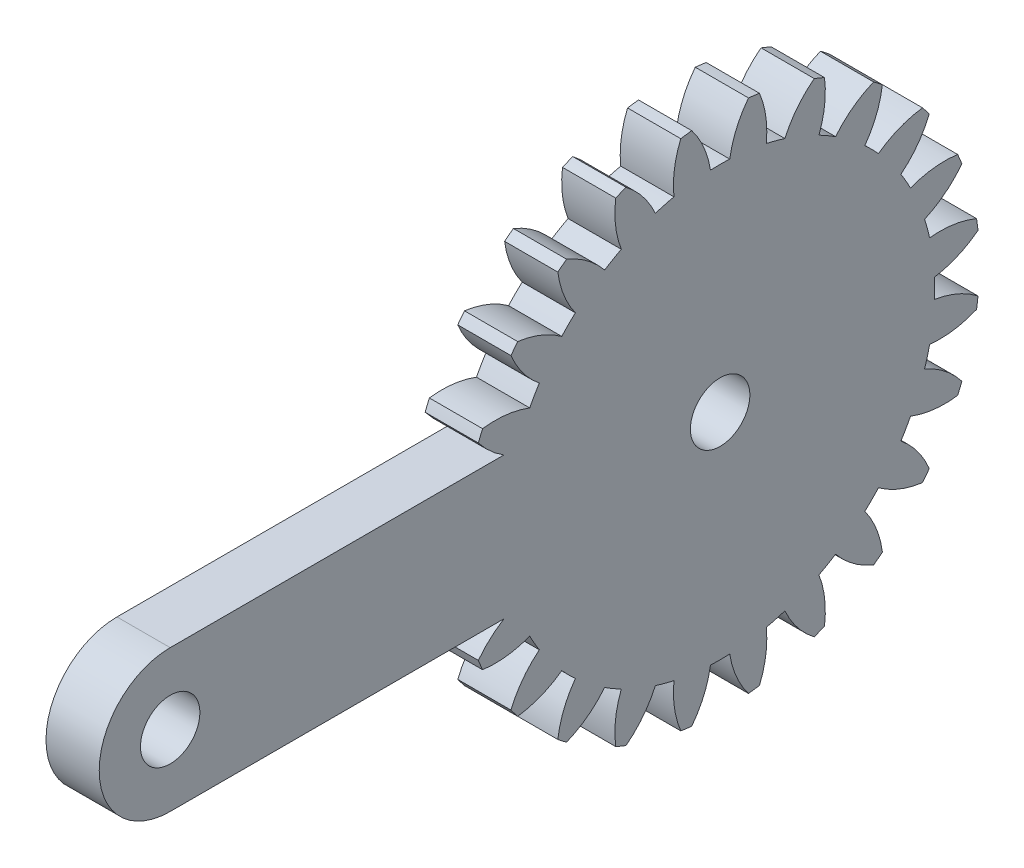
from build123d import *

# Parameters (mm, degrees)
SKETCH1_R           = 1.675
BOSS_EXTRUDE1_DEPTH = 3
SKETCH2_R           = 1.675
BOSS_EXTRUDE2_DEPTH = 3


with BuildPart() as part:
    # Sketch1 → Boss-Extrude1 (new body)
    with BuildSketch(Plane(origin=(3, 0, 0), x_dir=(0, 0, -1), z_dir=(1, 0, 0))):
        with BuildLine():
            ThreePointArc((-14.537314892, 1.599093719), (-13.375367565, 0.916420874), (-12.080565177, 0.542722358))
            ThreePointArc((-12.080565177, 0.542722358), (-12.09275, 0), (-12.080565177, -0.542722358))
            ThreePointArc((-12.080565177, -0.542722358), (-13.375367565, -0.916420874), (-14.537314892, -1.599093719))
            ThreePointArc((-14.537314892, -1.599093719), (-14.499881098, -1.908945561), (-14.455843809, -2.217928037))
            ThreePointArc((-14.455843809, -2.217928037), (-13.156800143, -2.576605271), (-11.809396783, -2.602450802))
            ThreePointArc((-11.809396783, -2.602450802), (-11.680699536, -3.129834008), (-11.528463019, -3.650909885))
            ThreePointArc((-11.528463019, -3.650909885), (-12.682425791, -4.346994451), (-13.62809199, -5.30713988))
            ThreePointArc((-13.62809199, -5.30713988), (-13.511738163, -5.596745198), (-13.389230859, -5.883801663))
            ThreePointArc((-13.389230859, -5.883801663), (-12.041618533, -5.894040025), (-10.733437515, -5.57027124))
            ThreePointArc((-10.733437515, -5.57027124), (-10.472628702, -6.046375), (-10.190715157, -6.510293938))
            ThreePointArc((-10.190715157, -6.510293938), (-11.125197659, -7.48132754), (-11.79013714, -8.65351323))
            ThreePointArc((-11.79013714, -8.65351323), (-11.602792602, -8.903135899), (-11.410163953, -9.148703928))
            ThreePointArc((-11.410163953, -9.148703928), (-10.105820521, -8.809805691), (-8.926012217, -8.158486898))
            ThreePointArc((-8.926012217, -8.158486898), (-8.550865528, -8.550865528), (-8.158486898, -8.926012217))
            ThreePointArc((-8.158486898, -8.926012217), (-8.809805691, -10.105820521), (-9.148703928, -11.410163953))
            ThreePointArc((-9.148703928, -11.410163953), (-8.903135899, -11.602792602), (-8.65351323, -11.79013714))
            ThreePointArc((-8.65351323, -11.79013714), (-7.48132754, -11.125197659), (-6.510293938, -10.190715157))
            ThreePointArc((-6.510293938, -10.190715157), (-6.046375, -10.472628702), (-5.57027124, -10.733437515))
            ThreePointArc((-5.57027124, -10.733437515), (-5.894040025, -12.041618533), (-5.883801663, -13.389230859))
            ThreePointArc((-5.883801663, -13.389230859), (-5.596745198, -13.511738163), (-5.30713988, -13.62809199))
            ThreePointArc((-5.30713988, -13.62809199), (-4.346994451, -12.682425791), (-3.650909885, -11.528463019))
            ThreePointArc((-3.650909885, -11.528463019), (-3.129834008, -11.680699536), (-2.602450802, -11.809396783))
            ThreePointArc((-2.602450802, -11.809396783), (-2.576605271, -13.156800143), (-2.217928037, -14.455843809))
            ThreePointArc((-2.217928037, -14.455843809), (-1.908945561, -14.499881098), (-1.599093719, -14.537314892))
            ThreePointArc((-1.599093719, -14.537314892), (-0.916420874, -13.375367565), (-0.542722358, -12.080565177))
            ThreePointArc((-0.542722358, -12.080565177), (0, -12.09275), (0.542722358, -12.080565177))
            ThreePointArc((0.542722358, -12.080565177), (0.916420874, -13.375367565), (1.599093719, -14.537314892))
            ThreePointArc((1.599093719, -14.537314892), (1.908945561, -14.499881098), (2.217928037, -14.455843809))
            ThreePointArc((2.217928037, -14.455843809), (2.576605271, -13.156800143), (2.602450802, -11.809396783))
            ThreePointArc((2.602450802, -11.809396783), (3.129834008, -11.680699536), (3.650909885, -11.528463019))
            ThreePointArc((3.650909885, -11.528463019), (4.346994451, -12.682425791), (5.30713988, -13.62809199))
            ThreePointArc((5.30713988, -13.62809199), (5.596745198, -13.511738163), (5.883801663, -13.389230859))
            ThreePointArc((5.883801663, -13.389230859), (5.894040025, -12.041618533), (5.57027124, -10.733437515))
            ThreePointArc((5.57027124, -10.733437515), (6.046375, -10.472628702), (6.510293938, -10.190715157))
            ThreePointArc((6.510293938, -10.190715157), (7.48132754, -11.125197659), (8.65351323, -11.79013714))
            ThreePointArc((8.65351323, -11.79013714), (8.903135899, -11.602792602), (9.148703928, -11.410163953))
            ThreePointArc((9.148703928, -11.410163953), (8.809805691, -10.105820521), (8.158486898, -8.926012217))
            ThreePointArc((8.158486898, -8.926012217), (8.550865528, -8.550865528), (8.926012217, -8.158486898))
            ThreePointArc((8.926012217, -8.158486898), (10.105820521, -8.809805691), (11.410163953, -9.148703928))
            ThreePointArc((11.410163953, -9.148703928), (11.602792602, -8.903135899), (11.79013714, -8.65351323))
            ThreePointArc((11.79013714, -8.65351323), (11.125197659, -7.48132754), (10.190715157, -6.510293938))
            ThreePointArc((10.190715157, -6.510293938), (10.472628702, -6.046375), (10.733437515, -5.57027124))
            ThreePointArc((10.733437515, -5.57027124), (12.041618533, -5.894040025), (13.389230859, -5.883801663))
            ThreePointArc((13.389230859, -5.883801663), (13.511738163, -5.596745198), (13.62809199, -5.30713988))
            ThreePointArc((13.62809199, -5.30713988), (12.682425791, -4.346994451), (11.528463019, -3.650909885))
            ThreePointArc((11.528463019, -3.650909885), (11.680699536, -3.129834008), (11.809396783, -2.602450802))
            ThreePointArc((11.809396783, -2.602450802), (13.156800143, -2.576605271), (14.455843809, -2.217928037))
            ThreePointArc((14.455843809, -2.217928037), (14.499881098, -1.908945561), (14.537314892, -1.599093719))
            ThreePointArc((14.537314892, -1.599093719), (13.375367565, -0.916420874), (12.080565177, -0.542722358))
            ThreePointArc((12.080565177, -0.542722358), (12.09275, 0), (12.080565177, 0.542722358))
            ThreePointArc((12.080565177, 0.542722358), (13.375367565, 0.916420874), (14.537314892, 1.599093719))
            ThreePointArc((14.537314892, 1.599093719), (14.499881098, 1.908945561), (14.455843809, 2.217928037))
            ThreePointArc((14.455843809, 2.217928037), (13.156800143, 2.576605271), (11.809396783, 2.602450802))
            ThreePointArc((11.809396783, 2.602450802), (11.680699536, 3.129834008), (11.528463019, 3.650909885))
            ThreePointArc((11.528463019, 3.650909885), (12.682425791, 4.346994451), (13.62809199, 5.30713988))
            ThreePointArc((13.62809199, 5.30713988), (13.511738163, 5.596745198), (13.389230859, 5.883801663))
            ThreePointArc((13.389230859, 5.883801663), (12.041618533, 5.894040025), (10.733437515, 5.57027124))
            ThreePointArc((10.733437515, 5.57027124), (10.472628702, 6.046375), (10.190715157, 6.510293938))
            ThreePointArc((10.190715157, 6.510293938), (11.125197659, 7.48132754), (11.79013714, 8.65351323))
            ThreePointArc((11.79013714, 8.65351323), (11.602792602, 8.903135899), (11.410163953, 9.148703928))
            ThreePointArc((11.410163953, 9.148703928), (10.105820521, 8.809805691), (8.926012217, 8.158486898))
            ThreePointArc((8.926012217, 8.158486898), (8.550865528, 8.550865528), (8.158486898, 8.926012217))
            ThreePointArc((8.158486898, 8.926012217), (8.809805691, 10.105820521), (9.148703928, 11.410163953))
            ThreePointArc((9.148703928, 11.410163953), (8.903135899, 11.602792602), (8.65351323, 11.79013714))
            ThreePointArc((8.65351323, 11.79013714), (7.48132754, 11.125197659), (6.510293938, 10.190715157))
            ThreePointArc((6.510293938, 10.190715157), (6.046375, 10.472628702), (5.57027124, 10.733437515))
            ThreePointArc((5.57027124, 10.733437515), (5.894040025, 12.041618533), (5.883801663, 13.389230859))
            ThreePointArc((5.883801663, 13.389230859), (5.596745198, 13.511738163), (5.30713988, 13.62809199))
            ThreePointArc((5.30713988, 13.62809199), (4.346994451, 12.682425791), (3.650909885, 11.528463019))
            ThreePointArc((3.650909885, 11.528463019), (3.129834008, 11.680699536), (2.602450802, 11.809396783))
            ThreePointArc((2.602450802, 11.809396783), (2.576605271, 13.156800143), (2.217928037, 14.455843809))
            ThreePointArc((2.217928037, 14.455843809), (1.908945561, 14.499881098), (1.599093719, 14.537314892))
            ThreePointArc((1.599093719, 14.537314892), (0.916420874, 13.375367565), (0.542722358, 12.080565177))
            ThreePointArc((0.542722358, 12.080565177), (0, 12.09275), (-0.542722358, 12.080565177))
            ThreePointArc((-0.542722358, 12.080565177), (-0.916420874, 13.375367565), (-1.599093719, 14.537314892))
            ThreePointArc((-1.599093719, 14.537314892), (-1.908945561, 14.499881098), (-2.217928037, 14.455843809))
            ThreePointArc((-2.217928037, 14.455843809), (-2.576605271, 13.156800143), (-2.602450802, 11.809396783))
            ThreePointArc((-2.602450802, 11.809396783), (-3.129834008, 11.680699536), (-3.650909885, 11.528463019))
            ThreePointArc((-3.650909885, 11.528463019), (-4.346994451, 12.682425791), (-5.30713988, 13.62809199))
            ThreePointArc((-5.30713988, 13.62809199), (-5.596745198, 13.511738163), (-5.883801663, 13.389230859))
            ThreePointArc((-5.883801663, 13.389230859), (-5.894040025, 12.041618533), (-5.57027124, 10.733437515))
            ThreePointArc((-5.57027124, 10.733437515), (-6.046375, 10.472628702), (-6.510293938, 10.190715157))
            ThreePointArc((-6.510293938, 10.190715157), (-7.48132754, 11.125197659), (-8.65351323, 11.79013714))
            ThreePointArc((-8.65351323, 11.79013714), (-8.903135899, 11.602792602), (-9.148703928, 11.410163953))
            ThreePointArc((-9.148703928, 11.410163953), (-8.809805691, 10.105820521), (-8.158486898, 8.926012217))
            ThreePointArc((-8.158486898, 8.926012217), (-8.550865528, 8.550865528), (-8.926012217, 8.158486898))
            ThreePointArc((-8.926012217, 8.158486898), (-10.105820521, 8.809805691), (-11.410163953, 9.148703928))
            ThreePointArc((-11.410163953, 9.148703928), (-11.602792602, 8.903135899), (-11.79013714, 8.65351323))
            ThreePointArc((-11.79013714, 8.65351323), (-11.125197659, 7.48132754), (-10.190715157, 6.510293938))
            ThreePointArc((-10.190715157, 6.510293938), (-10.472628702, 6.046375), (-10.733437515, 5.57027124))
            ThreePointArc((-10.733437515, 5.57027124), (-12.041618533, 5.894040025), (-13.389230859, 5.883801663))
            ThreePointArc((-13.389230859, 5.883801663), (-13.511738163, 5.596745198), (-13.62809199, 5.30713988))
            ThreePointArc((-13.62809199, 5.30713988), (-12.682425791, 4.346994451), (-11.528463019, 3.650909885))
            ThreePointArc((-11.528463019, 3.650909885), (-11.680699536, 3.129834008), (-11.809396783, 2.602450802))
            ThreePointArc((-11.809396783, 2.602450802), (-13.156800143, 2.576605271), (-14.455843809, 2.217928037))
            ThreePointArc((-14.455843809, 2.217928037), (-14.499881098, 1.908945561), (-14.537314892, 1.599093719))
        make_face()
        with Locations(Location((0, 0, 0), (0, 0, 180))):
            Circle(SKETCH1_R, mode=Mode.SUBTRACT)
    extrude(amount=-BOSS_EXTRUDE1_DEPTH)

    # Sketch2 → Boss-Extrude2 (add)
    with BuildSketch(Plane(origin=(3, 0, 0), x_dir=(0, 0, -1), z_dir=(1, 0, 0))):
        with BuildLine():
            Line((0, -4), (-31, -4))
            ThreePointArc((-31, -4), (-35, 0), (-31, 4))
            Line((-31, 4), (0, 4))
            ThreePointArc((0, 4), (4, 0), (0, -4))
        make_face()
        with Locations((-31, 0)):
            Circle(SKETCH2_R, mode=Mode.SUBTRACT)
        with Locations(Location((0, 0, 0), (0, 0, 180))):
            Circle(SKETCH2_R, mode=Mode.SUBTRACT)
    extrude(amount=-BOSS_EXTRUDE2_DEPTH)


solid = part.part
